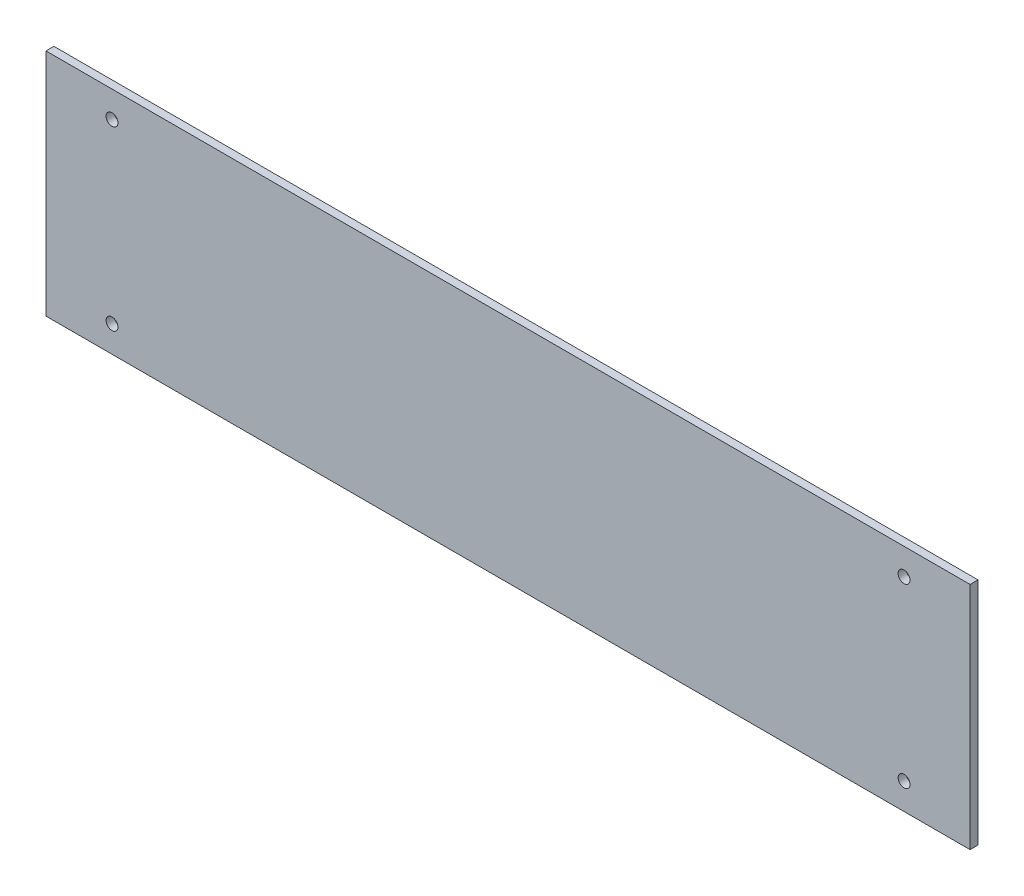
from build123d import *

# Parameters (mm, degrees)
ESQUISSE1_W             = 350
ESQUISSE1_H             = 87
BOSS_EXTRU_1_DEPTH      = 3
ENL_V_MAT_EXTRU_1_REACH = 182.35
ESQUISSE2_R             = 2.25


with BuildPart() as part:
    # Esquisse1 → Boss.-Extru.1 (new body)
    with BuildSketch(Plane.XY):
        Rectangle(ESQUISSE1_W, ESQUISSE1_H)
    extrude(amount=BOSS_EXTRU_1_DEPTH)

    # Esquisse2 → Enlèv. mat.-Extru.1 (cut, up to next)
    with BuildSketch(Plane.XY.offset(3), mode=Mode.PRIVATE) as enl_v_mat_extru_1_sk1:
        with Locations((-150, 33.5)):
            Circle(ESQUISSE2_R)
    enl_v_mat_extru_1_tool1 = extrude(enl_v_mat_extru_1_sk1.sketch, amount=-ENL_V_MAT_EXTRU_1_REACH, mode=Mode.PRIVATE) & part.part
    # Esquisse2 → Enlèv. mat.-Extru.1 (cut, up to next)
    with BuildSketch(Plane.XY.offset(3), mode=Mode.PRIVATE) as enl_v_mat_extru_1_sk2:
        with Locations((-150, -33.5)):
            Circle(ESQUISSE2_R)
    enl_v_mat_extru_1_tool2 = extrude(enl_v_mat_extru_1_sk2.sketch, amount=-ENL_V_MAT_EXTRU_1_REACH, mode=Mode.PRIVATE) & part.part
    # Esquisse2 → Enlèv. mat.-Extru.1 (cut, up to next)
    with BuildSketch(Plane.XY.offset(3), mode=Mode.PRIVATE) as enl_v_mat_extru_1_sk3:
        with Locations((150, 33.5)):
            Circle(ESQUISSE2_R)
    enl_v_mat_extru_1_tool3 = extrude(enl_v_mat_extru_1_sk3.sketch, amount=-ENL_V_MAT_EXTRU_1_REACH, mode=Mode.PRIVATE) & part.part
    # Esquisse2 → Enlèv. mat.-Extru.1 (cut, up to next)
    with BuildSketch(Plane.XY.offset(3), mode=Mode.PRIVATE) as enl_v_mat_extru_1_sk4:
        with Locations((150, -33.5)):
            Circle(ESQUISSE2_R)
    enl_v_mat_extru_1_tool4 = extrude(enl_v_mat_extru_1_sk4.sketch, amount=-ENL_V_MAT_EXTRU_1_REACH, mode=Mode.PRIVATE) & part.part
    add(enl_v_mat_extru_1_tool1.solids().sort_by_distance((-150, 33.5, 3))[0], mode=Mode.SUBTRACT)
    add(enl_v_mat_extru_1_tool2.solids().sort_by_distance((-150, -33.5, 3))[0], mode=Mode.SUBTRACT)
    add(enl_v_mat_extru_1_tool3.solids().sort_by_distance((150, 33.5, 3))[0], mode=Mode.SUBTRACT)
    add(enl_v_mat_extru_1_tool4.solids().sort_by_distance((150, -33.5, 3))[0], mode=Mode.SUBTRACT)


solid = part.part
